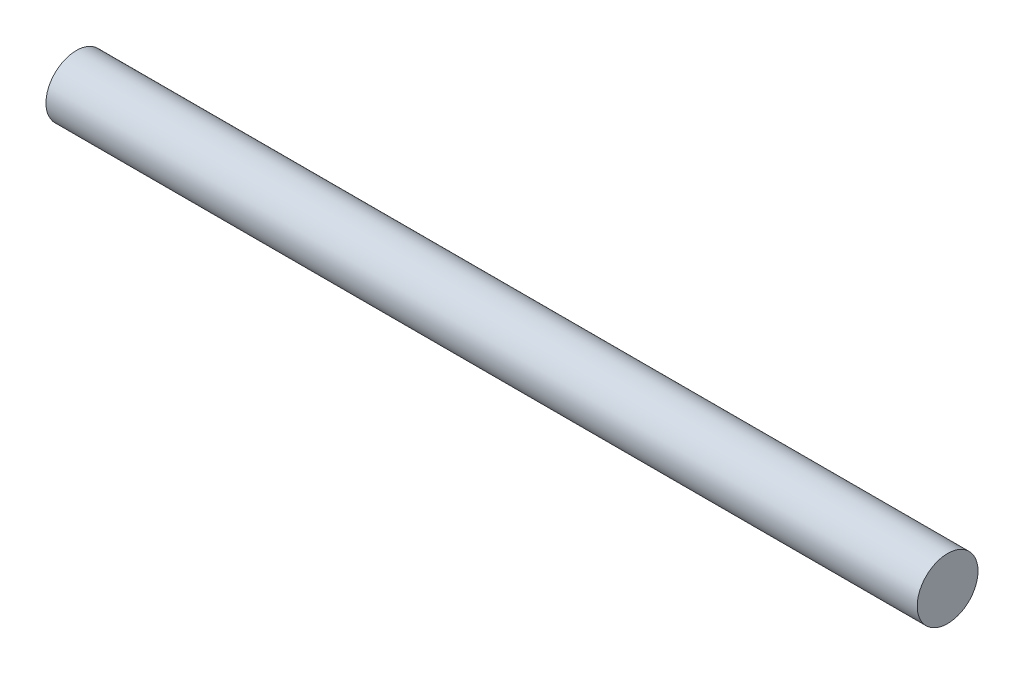
from build123d import *

# Parameters (mm, degrees)
ESQUISSE1_R        = 15
BOSS_EXTRU_1_DEPTH = 430


with BuildPart() as part:
    # Esquisse1 → Boss.-Extru.1 (new body)
    with BuildSketch(Plane(origin=(0, 0, 0), x_dir=(0, 0, -1), z_dir=(1, 0, 0))):
        Circle(ESQUISSE1_R)
    extrude(amount=BOSS_EXTRU_1_DEPTH)


solid = part.part
